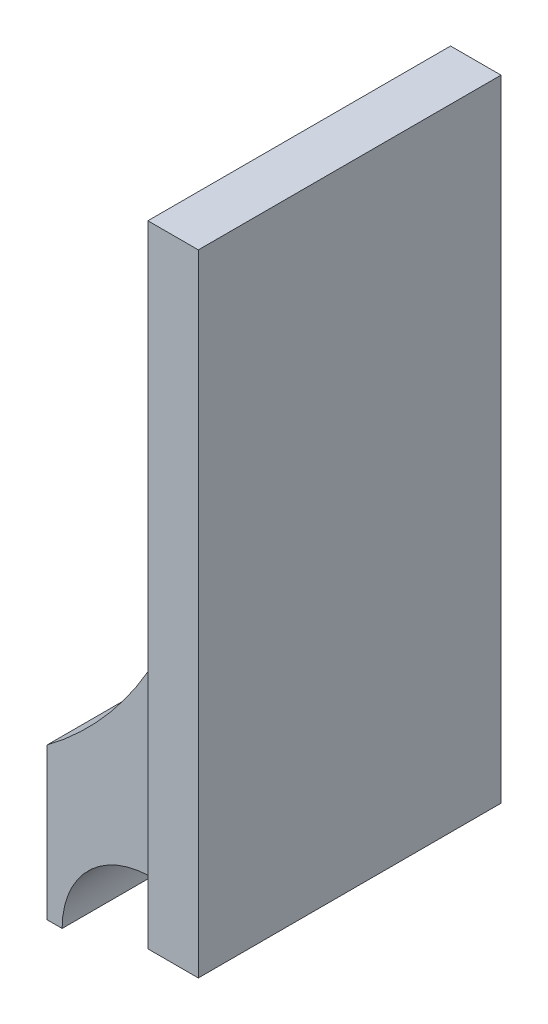
from build123d import *

# Parameters (mm, degrees)
SKETCH1_W           = 12
SKETCH1_H           = 25
BOSS_EXTRUDE1_DEPTH = 2
BOSS_EXTRUDE2_DEPTH = 12
CUT_EXTRUDE1_REACH  = 20.446
SKETCH3_W           = 23.047029748
SKETCH3_H           = 41.13404119
SKETCH3_W_2         = 8
SKETCH3_H_2         = 35.39542334


with BuildPart() as part:
    # Sketch1 → Boss-Extrude1 (new body)
    with BuildSketch(Plane(origin=(0, 0, 0), x_dir=(0, 0, -1), z_dir=(1, 0, 0))):
        Rectangle(SKETCH1_W, SKETCH1_H)
    extrude(amount=BOSS_EXTRUDE1_DEPTH)

    # Sketch2 → Boss-Extrude2 (add)
    with BuildSketch(Plane.XY.offset(6)):
        with BuildLine():
            Line((-6, -9.5), (-6, -15.5))
            Line((-6, -15.5), (-5.4, -15.5))
            ThreePointArc((-5.4, -15.5), (-3.582605023, -12.411310958), (0, -12.5))
            Line((0, -12.5), (0, 2.5))
            ThreePointArc((0, 2.5), (-1.583592135, -4.208203932), (-6, -9.5))
        make_face()
    extrude(amount=-BOSS_EXTRUDE2_DEPTH)

    # Cut-Extrude1: up to this face of the body (flat: up to its plane)
    cut_extrude1_end = Plane(part.part.faces().sort_by_distance((0, 7.5, 0))[0])
    # Sketch3 → Cut-Extrude1 (cut, up to the picked face)
    with BuildSketch(Plane.ZY.offset(6), mode=Mode.PRIVATE) as cut_extrude1_sk1:
        Rectangle(SKETCH3_W, SKETCH3_H)
        Rectangle(SKETCH3_W_2, SKETCH3_H_2, mode=Mode.SUBTRACT)
    cut_extrude1_tool1 = split(extrude(cut_extrude1_sk1.sketch, amount=-CUT_EXTRUDE1_REACH, mode=Mode.PRIVATE), bisect_by=cut_extrude1_end, keep=Keep.BOTH, mode=Mode.PRIVATE)
    add(cut_extrude1_tool1.solids().sort_by(Axis((-6, 20.095515, 0), (1, 0, 0)))[0], mode=Mode.SUBTRACT)


solid = part.part
